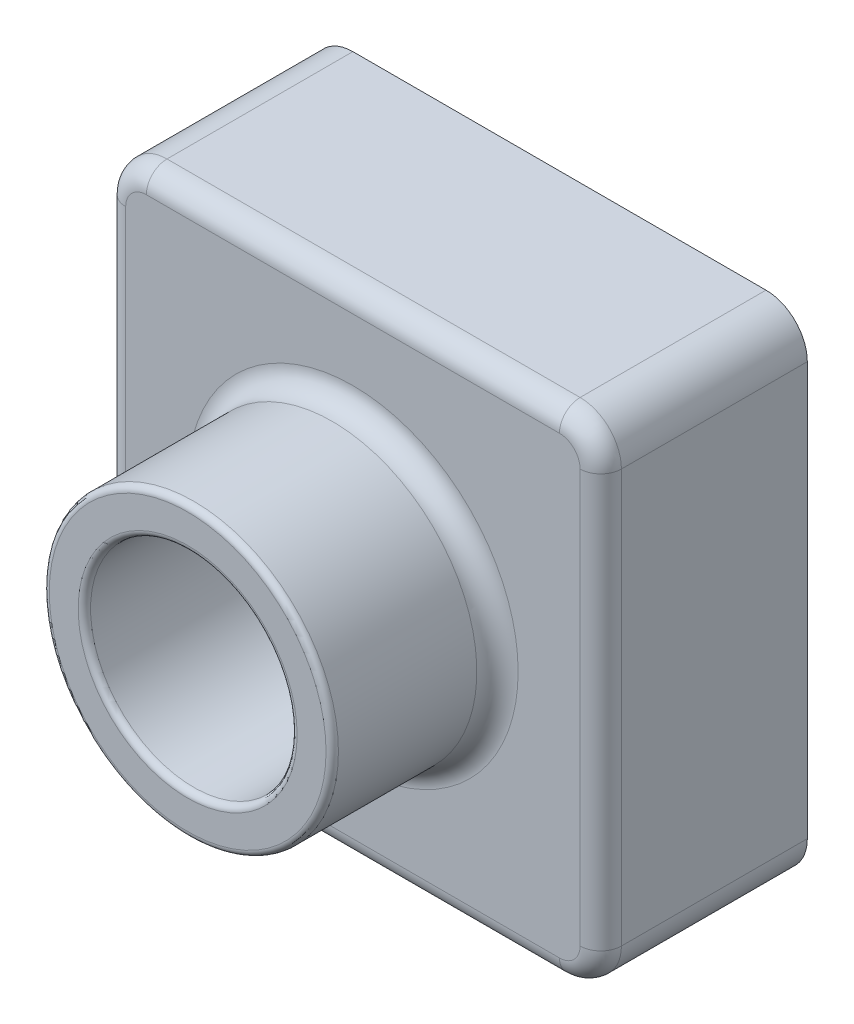
from build123d import *

# Parameters (mm, degrees)
SKETCH1_W           = 120
SKETCH1_H           = 120
BOSS_EXTRUDE1_DEPTH = 50
SKETCH2_R           = 35
BOSS_EXTRUDE2_DEPTH = 40
SKETCH3_R           = 25
CUT_EXTRUDE1_DEPTH  = 193.093727123
FILLET1_R           = 10
FILLET2_R           = 1.5
FILLET3_R           = 5
SHELL1_T            = -2


with BuildPart() as part:
    # Sketch1 → Boss-Extrude1 (new body)
    with BuildSketch(Plane.XY):
        with Locations((60, 60)):
            Rectangle(SKETCH1_W, SKETCH1_H)
    extrude(amount=BOSS_EXTRUDE1_DEPTH)

    # Sketch2 → Boss-Extrude2 (add)
    with BuildSketch(Plane.XY.offset(50)):
        with Locations((60, 60)):
            Circle(SKETCH2_R)
    extrude(amount=BOSS_EXTRUDE2_DEPTH)

    # Sketch3 → Cut-Extrude1 (cut, through all)
    with BuildSketch(Plane.XY.offset(90)):
        with Locations((60, 60)):
            Circle(SKETCH3_R)
    extrude(amount=-CUT_EXTRUDE1_DEPTH, mode=Mode.SUBTRACT)

    # Fillet1
    fillet1_edges = [part.edges().sort_by_distance(p)[0] for p in [
        (0, 0, 25),
        (120, 0, 25),
        (120, 120, 25),
        (0, 120, 25),
    ]]
    fillet(fillet1_edges, radius=FILLET1_R)

    # Fillet2
    fillet2_edges = [part.edges().sort_by_distance(p)[0] for p in [
        (25, 60, 90),
        (35, 60, 90),
    ]]
    fillet(fillet2_edges, radius=FILLET2_R)

    # Fillet3
    fillet3_edges = [part.edges().sort_by_distance(p)[0] for p in [
        (25, 60, 50),
        (0, 60, 50),
        (60, 120, 50),
        (60, 0, 50),
        (120, 60, 50),
        (117.071067812, 117.071067812, 50),
        (117.071067812, 2.928932188, 50),
        (2.928932188, 2.928932188, 50),
        (2.928932188, 117.071067812, 50),
    ]]
    fillet(fillet3_edges, radius=FILLET3_R)

    # Shell1
    shell1_openings = [part.faces().sort_by_distance(p)[0] for p in [
        (60, 1.697056275, 0),
    ]]
    offset(amount=SHELL1_T, openings=shell1_openings, kind=Kind.INTERSECTION)


solid = part.part
